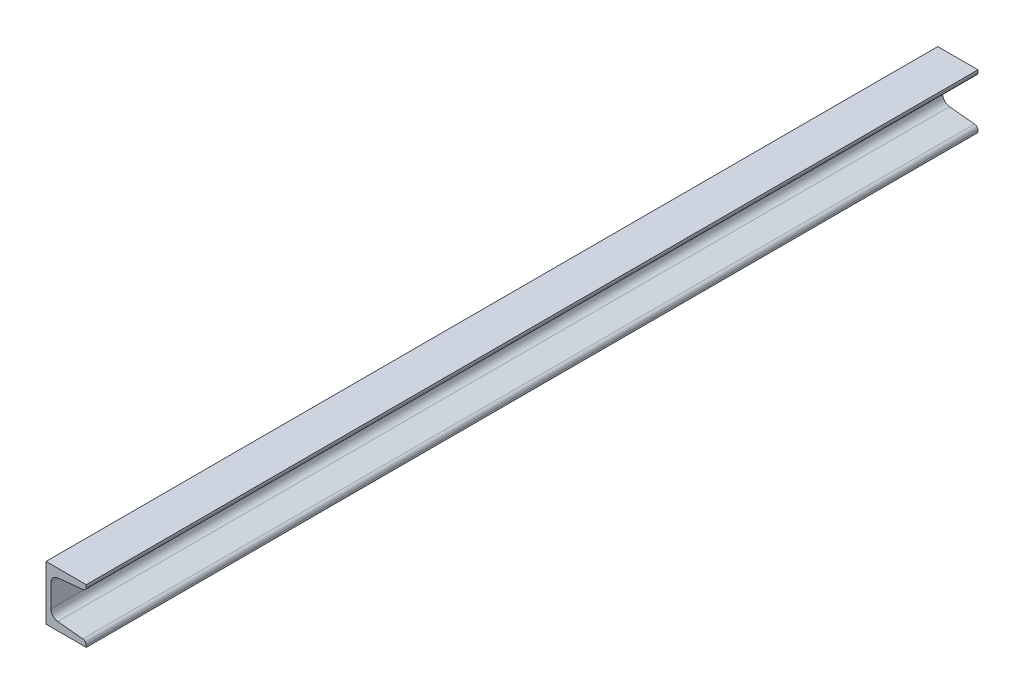
from build123d import *

# Parameters (mm, degrees)
EXTRUDE_1_DEPTH = 820


with BuildPart() as part:
    # 草图1 → 凸台-拉伸1 (new body)
    with BuildSketch(Plane.XY):
        with BuildLine():
            Line((0, 0), (0, 50))
            Line((0, 50), (37, 50))
            Line((37, 50), (37, 48.040012398))
            ThreePointArc((37, 48.040012398), (36.095083867, 45.691493776), (33.848263017, 44.557382233))
            Line((33.848263017, 44.557382233), (10.803473967, 42.252903328))
            ThreePointArc((10.803473967, 42.252903328), (6.309832265, 39.984680242), (4.5, 35.287642996))
            Line((4.5, 35.287642996), (4.5, 14.509912935))
            ThreePointArc((4.5, 14.509912935), (6.309832265, 9.812875689), (10.803473967, 7.544652603))
            Line((10.803473967, 7.544652603), (33.848263017, 5.240173698))
            ThreePointArc((33.848263017, 5.240173698), (36.095083867, 4.106062155), (37, 1.757543533))
            Line((37, 1.757543533), (37, 0))
            Line((37, 0), (0, 0))
        make_face()
    extrude(amount=EXTRUDE_1_DEPTH)


solid = part.part
